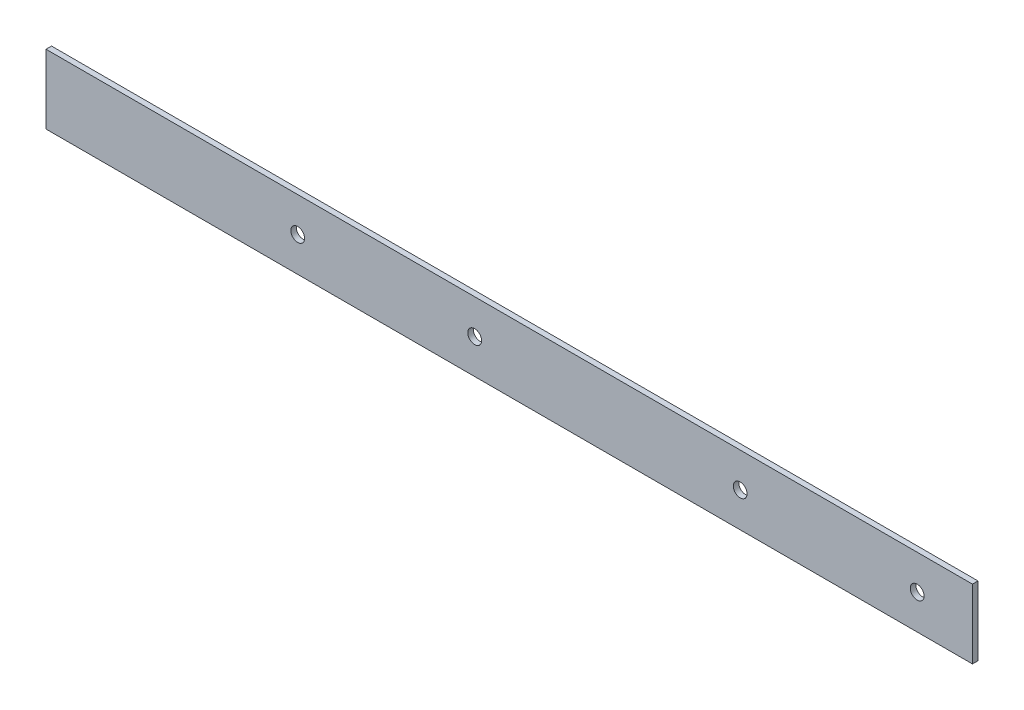
from build123d import *

# Parameters (mm, degrees)
SKETCH_1_W          = 335
SKETCH_1_H          = 25
EXTRUDE_1_DEPTH     = 2
SKETCH_2_R          = 2.5
CUT_EXTRUDE_1_DEPTH = 168.977677088


with BuildPart() as part:
    # 草图1 → 凸台-拉伸1 (new body)
    with BuildSketch(Plane.XY):
        Rectangle(SKETCH_1_W, SKETCH_1_H)
    extrude(amount=EXTRUDE_1_DEPTH)

    # 草图2 → 切除-拉伸1 (cut, through all)
    with BuildSketch(Plane.XY.offset(2)):
        with Locations((-76.5, 0)):
            Circle(SKETCH_2_R)
        with Locations((-12.5, 0)):
            Circle(SKETCH_2_R)
        with Locations((83.5, 0)):
            Circle(SKETCH_2_R)
        with Locations((147.5, 0)):
            Circle(SKETCH_2_R)
    extrude(amount=-CUT_EXTRUDE_1_DEPTH, mode=Mode.SUBTRACT)


solid = part.part
